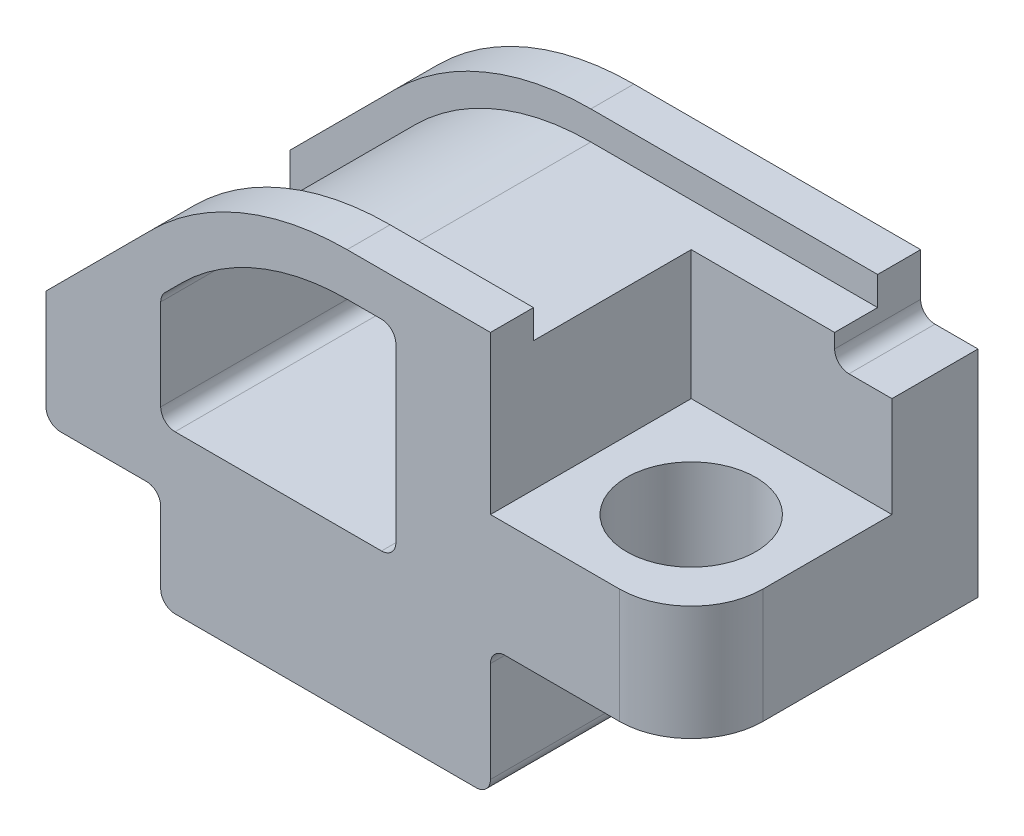
from build123d import *

# Parameters (mm, degrees)
BOSS_EXTRUDE1_DEPTH = 50
CUT_EXTRUDE1_DEPTH  = 268.675176286
CUT_EXTRUDE3_DEPTH  = 35
SKETCH6_W           = 70
SKETCH6_H           = 70
CUT_EXTRUDE4_DEPTH  = 55
SKETCH7_R           = 22.5
CUT_EXTRUDE5_DEPTH  = 246.662369931
FILLET1_R           = 25
FILLET2_R           = 5
FILLET3_R           = 5


with BuildPart() as part:
    # Sketch1 → Boss-Extrude1 (new, symmetric)
    with BuildSketch(Plane.XY):
        with BuildLine():
            Line((0, 0), (40, 0))
            Line((40, 0), (40, -35))
            Line((40, -35), (155, -35))
            Line((155, -35), (155, 10))
            Line((155, 10), (225, 10))
            Line((225, 10), (225, 85))
            Line((225, 85), (205, 85))
            Line((205, 85), (205, 105))
            Line((205, 105), (105, 105))
            ThreePointArc((105, 105), (68.0448187, 97.649157401), (36.715728753, 76.715728753))
            Line((36.715728753, 76.715728753), (0, 40))
            Line((0, 40), (0, 0))
        make_face()
    extrude(amount=BOSS_EXTRUDE1_DEPTH, both=True)

    # Sketch2 → Cut-Extrude1 (cut, through all)
    with BuildSketch(Plane.XY.offset(50)):
        with BuildLine():
            Line((40, 58.786796564), (40, 20))
            Line((40, 20), (122, 20))
            Line((122, 20), (122, 90))
            Line((122, 90), (105, 90))
            ThreePointArc((105, 90), (73.785070185, 83.790964413), (47.32233047, 66.109127035))
            Line((47.32233047, 66.109127035), (40, 58.786796564))
        make_face()
    extrude(amount=-CUT_EXTRUDE1_DEPTH, mode=Mode.SUBTRACT)

    # Sketch5 → Cut-Extrude3 (cut, symmetric)
    with BuildSketch(Plane.XY):
        with BuildLine():
            Line((205, 95), (105, 95))
            ThreePointArc((105, 95), (71.871653023, 88.410362075), (43.786796564, 69.644660941))
            Line((43.786796564, 69.644660941), (0, 25.857864376))
            Line((0, 25.857864376), (0, 40))
            Line((0, 40), (36.715728753, 76.715728753))
            ThreePointArc((36.715728753, 76.715728753), (68.0448187, 97.649157401), (105, 105))
            Line((105, 105), (205, 105))
            Line((205, 105), (205, 95))
        make_face()
    extrude(amount=CUT_EXTRUDE3_DEPTH, both=True, mode=Mode.SUBTRACT)

    # Sketch6 → Cut-Extrude4 (cut)
    with BuildSketch(Plane(origin=(0, 105, 0), x_dir=(1, 0, 0), z_dir=(0, 1, 0))):
        with Locations((190, -15)):
            Rectangle(SKETCH6_W, SKETCH6_H)
    extrude(amount=-CUT_EXTRUDE4_DEPTH, mode=Mode.SUBTRACT)

    # Sketch7 → Cut-Extrude5 (cut, through all)
    with BuildSketch(Plane(origin=(0, 50, 0), x_dir=(1, 0, 0), z_dir=(0, 1, 0))):
        with Locations(Location((190, -15, 0), (0, 0, 180))):
            Circle(SKETCH7_R)
    extrude(amount=-CUT_EXTRUDE5_DEPTH, mode=Mode.SUBTRACT)

    # Fillet1
    fillet1_edges = [part.edges().sort_by_distance(p)[0] for p in [
        (225, 30, 50),
    ]]
    fillet(fillet1_edges, radius=FILLET1_R)

    # Fillet2
    fillet2_edges = [part.edges().sort_by_distance(p)[0] for p in [
        (155, 10, 0),
        (155, -35, 0),
        (40, -35, 0),
        (40, 0, 0),
        (0, 0, 0),
        (205, 85, -35),
    ]]
    fillet(fillet2_edges, radius=FILLET2_R)

    # Fillet3
    fillet3_edges = [part.edges().sort_by_distance(p)[0] for p in [
        (122, 90, 0),
        (122, 20, 0),
        (40, 20, 0),
        (40, 58.786796564, 0),
    ]]
    fillet(fillet3_edges, radius=FILLET3_R)


solid = part.part
